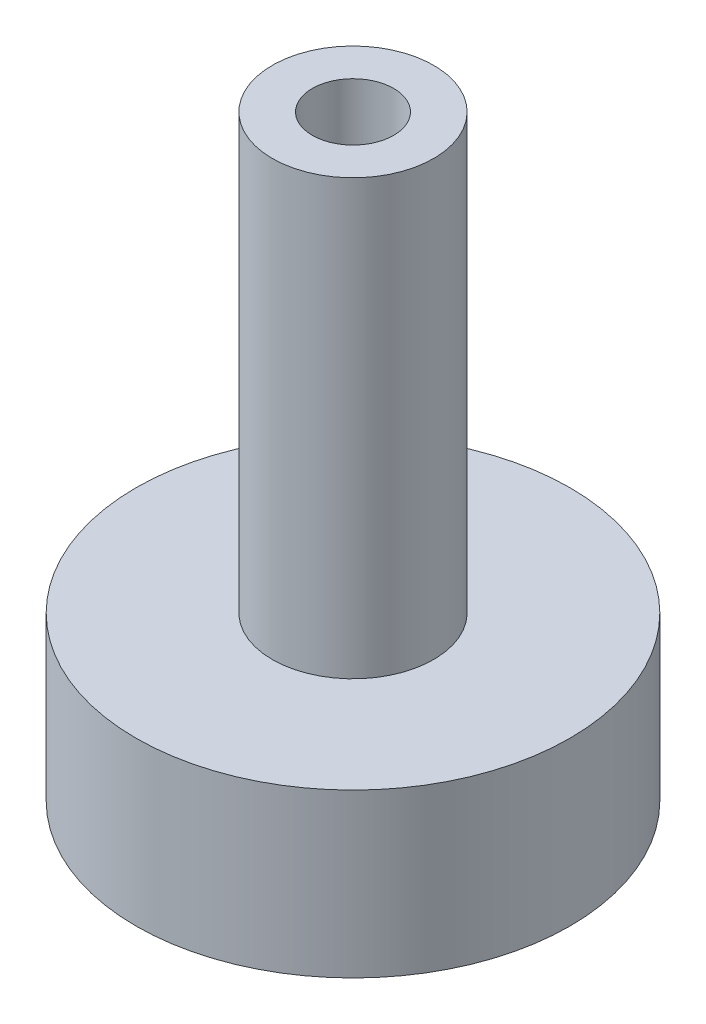
from build123d import *

# Parameters (mm, degrees)
SKETCH1_R           = 6.35
BOSS_EXTRUDE1_DEPTH = 4.7625
SKETCH4_R           = 2.3622
SKETCH4_R_2         = 1.190625
BOSS_EXTRUDE2_DEPTH = 17.4625


with BuildPart() as part:
    # Sketch1 → Boss-Extrude1 (new body)
    with BuildSketch(Plane(origin=(0, 0, 0), x_dir=(1, 0, 0), z_dir=(0, 1, 0))):
        with Locations(Location((-27.91812688, -5.991014352, 0), (0, 0, 90))):
            Circle(SKETCH1_R)
    extrude(amount=BOSS_EXTRUDE1_DEPTH)

    # Sketch4 → Boss-Extrude2 (add)
    with BuildSketch(Plane(origin=(0, 0, 0), x_dir=(1, 0, 0), z_dir=(0, 1, 0))):
        with Locations(Location((-27.91812688, -5.991014352, 0), (0, 0, 270))):
            Circle(SKETCH4_R)
        with Locations(Location((-27.91812688, -5.991014352, 0), (0, 0, 270))):
            Circle(SKETCH4_R_2, mode=Mode.SUBTRACT)
    extrude(amount=BOSS_EXTRUDE2_DEPTH)


solid = part.part
